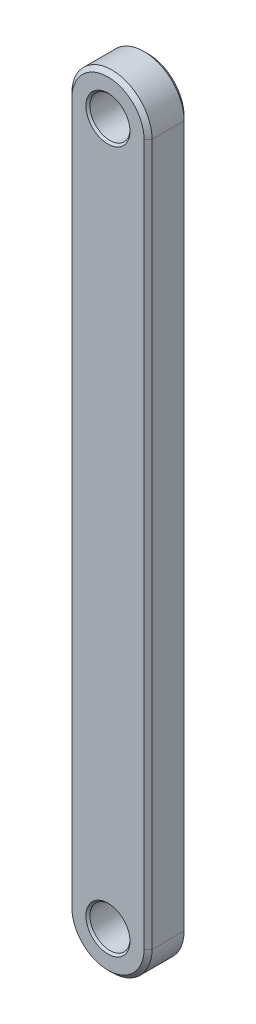
from build123d import *

# Parameters (mm, degrees)
SKETCH1_R           = 1
BOSS_EXTRUDE1_DEPTH = 1
CHAMFER1_SIZE       = 0.2
CHAMFER2_SIZE       = 0.1


with BuildPart() as part:
    # Sketch1 → Boss-Extrude1 (new, symmetric)
    with BuildSketch(Plane.XY):
        with BuildLine():
            Line((-2, -17.5), (-2, 17.5))
            ThreePointArc((-2, 17.5), (0, 19.5), (2, 17.5))
            Line((2, 17.5), (2, -17.5))
            ThreePointArc((2, -17.5), (0, -19.5), (-2, -17.5))
        make_face()
        with Locations((0, 17.5)):
            Circle(SKETCH1_R, mode=Mode.SUBTRACT)
        with Locations((0, -17.5)):
            Circle(SKETCH1_R, mode=Mode.SUBTRACT)
    extrude(amount=BOSS_EXTRUDE1_DEPTH, both=True)

    # Chamfer1
    chamfer1_edges = [part.edges().sort_by_distance(p)[0] for p in [
        (0, 19.5, 1),
        (-2, 0, 1),
        (0, -19.5, 1),
        (-2, 0, -1),
        (0, 19.5, -1),
        (2, 0, -1),
        (0, -19.5, -1),
        (2, 0, 1),
    ]]
    chamfer(chamfer1_edges, length=CHAMFER1_SIZE)

    # Chamfer2
    chamfer2_edges = [part.edges().sort_by_distance(p)[0] for p in [
        (-1, 17.5, -1),
        (-1, 17.5, 1),
        (-1, -17.5, -1),
        (-1, -17.5, 1),
    ]]
    chamfer(chamfer2_edges, length=CHAMFER2_SIZE)


solid = part.part
